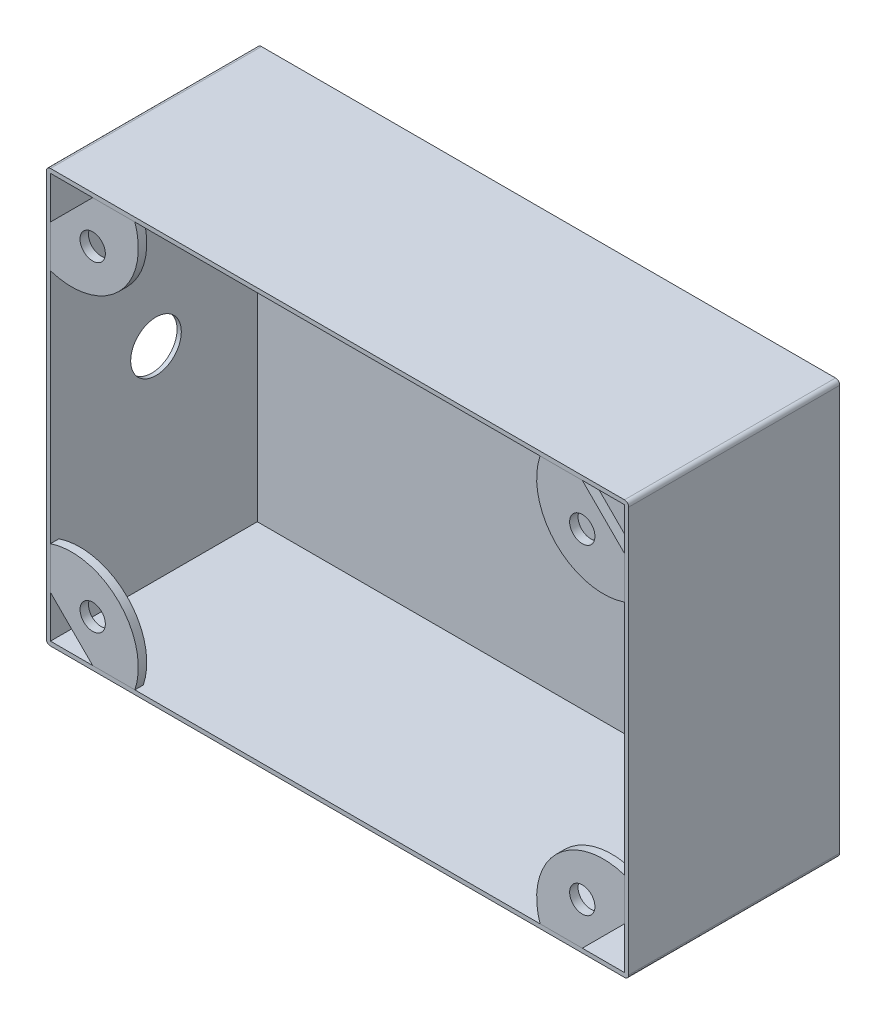
from build123d import *

# Parameters (mm, degrees)
CROQUIS1_W                = 138
CROQUIS1_H                = 98
CROQUIS1_W_2              = 136
CROQUIS1_H_2              = 96
SALIENTE_EXTRUIR2_DEPTH   = 50
CROQUIS2_W                = 136
CROQUIS2_H                = 96
SALIENTE_EXTRUIR3_DEPTH   = 1
REDONDEO1_R               = 1
CROQUIS7_R                = 3
SALIENTE_EXTRUIR6_DEPTH   = 2
SALIENTE_EXTRUIR6_2_DEPTH = 2
SALIENTE_EXTRUIR6_3_DEPTH = 2
SALIENTE_EXTRUIR6_4_DEPTH = 2
CROQUIS8_R                = 6
CORTAR_EXTRUIR1_DEPTH     = 2


with BuildPart() as part:
    # Croquis1 → Saliente-Extruir2 (new body)
    with BuildSketch(Plane.XY):
        Rectangle(CROQUIS1_W, CROQUIS1_H)
        Rectangle(CROQUIS1_W_2, CROQUIS1_H_2, mode=Mode.SUBTRACT)
    extrude(amount=SALIENTE_EXTRUIR2_DEPTH)

    # Croquis2 → Saliente-Extruir3 (add)
    with BuildSketch(Plane.XY):
        Rectangle(CROQUIS2_W, CROQUIS2_H)
    extrude(amount=SALIENTE_EXTRUIR3_DEPTH)

    # Redondeo1
    redondeo1_edges = [part.edges().sort_by_distance(p)[0] for p in [
        (69, -49, 25),
        (-69, -49, 25),
        (-69, 49, 25),
        (69, 49, 25),
    ]]
    fillet(redondeo1_edges, radius=REDONDEO1_R)

    # Croquis8 → Cortar-Extruir1 (cut)
    with BuildSketch(Plane.ZY.offset(69)):
        with Locations((25, 0)):
            Circle(CROQUIS8_R)
    extrude(amount=-CORTAR_EXTRUIR1_DEPTH, mode=Mode.SUBTRACT)


with BuildPart() as body_2:
    # Croquis7 → Saliente-Extruir6 (new body)
    with BuildSketch(Plane.XY.offset(50)):
        with BuildLine():
            Line((-68, 38), (-58, 48))
            Line((-58, 48), (-48, 48))
            ThreePointArc((-48, 48), (-51.819660113, 31.819660113), (-68, 28))
            Line((-68, 28), (-68, 38))
        make_face()
        with Locations((-58, 38)):
            Circle(CROQUIS7_R, mode=Mode.SUBTRACT)
    extrude(amount=-SALIENTE_EXTRUIR6_DEPTH)


with BuildPart() as body_3:
    # Croquis7 → Saliente-Extruir6 2 (new body)
    with BuildSketch(Plane.XY.offset(50)):
        with BuildLine():
            Line((58, 48), (48, 48))
            ThreePointArc((48, 48), (51.819660113, 31.819660113), (68, 28))
            Line((68, 28), (68, 38))
            Line((68, 38), (58, 48))
        make_face()
        with Locations(Location((58, 38, 0), (0, 0, 180))):
            Circle(CROQUIS7_R, mode=Mode.SUBTRACT)
    extrude(amount=-SALIENTE_EXTRUIR6_2_DEPTH)


with BuildPart() as body_4:
    # Croquis7 → Saliente-Extruir6 3 (new body)
    with BuildSketch(Plane.XY.offset(50)):
        with BuildLine():
            Line((58, -48), (48, -48))
            ThreePointArc((48, -48), (51.819660113, -31.819660113), (68, -28))
            Line((68, -28), (68, -38))
            Line((68, -38), (58, -48))
        make_face()
        with Locations((58, -38)):
            Circle(CROQUIS7_R, mode=Mode.SUBTRACT)
    extrude(amount=-SALIENTE_EXTRUIR6_3_DEPTH)


with BuildPart() as body_5:
    # Croquis7 → Saliente-Extruir6 4 (new body)
    with BuildSketch(Plane.XY.offset(50)):
        with BuildLine():
            Line((-68, -38), (-68, -28))
            ThreePointArc((-68, -28), (-51.819660113, -31.819660113), (-48, -48))
            Line((-48, -48), (-58, -48))
            Line((-58, -48), (-68, -38))
        make_face()
        with Locations(Location((-58, -38, 0), (0, 0, 180))):
            Circle(CROQUIS7_R, mode=Mode.SUBTRACT)
    extrude(amount=-SALIENTE_EXTRUIR6_4_DEPTH)


solid = Compound([part.part, body_2.part, body_3.part, body_4.part, body_5.part])
